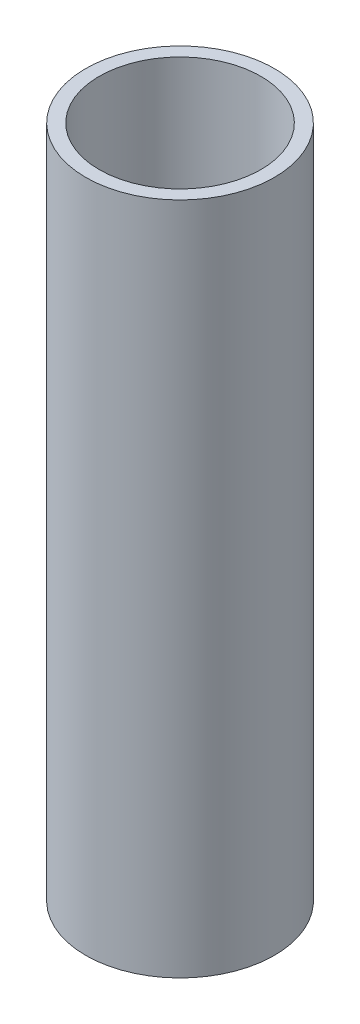
from build123d import *

# Parameters (mm, degrees)
SKETCH2_R           = 3.5
SKETCH2_R_2         = 3
BOSS_EXTRUDE1_DEPTH = 25


with BuildPart() as part:
    # Sketch2 → Boss-Extrude1 (new body)
    with BuildSketch(Plane(origin=(0, 0, 0), x_dir=(1, 0, 0), z_dir=(0, 1, 0))):
        with Locations(Location((0, 0, 0), (0, 0, 270))):
            Circle(SKETCH2_R)
        with Locations(Location((0, 0, 0), (0, 0, 270))):
            Circle(SKETCH2_R_2, mode=Mode.SUBTRACT)
    extrude(amount=BOSS_EXTRUDE1_DEPTH)


solid = part.part
